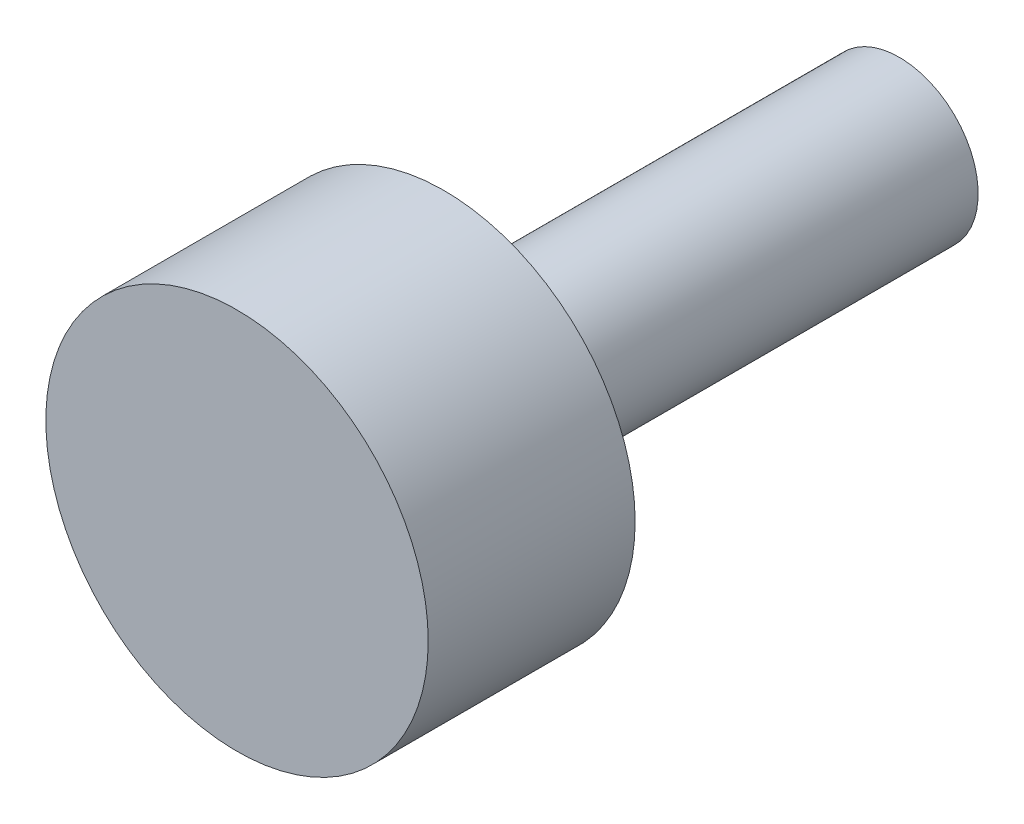
from build123d import *

# Parameters (mm, degrees)
SKETCH_1_R      = 8.5
EXTRUDE_1_DEPTH = 9.2
SKETCH_2_R      = 3.5
EXTRUDE_2_DEPTH = 20.25


with BuildPart() as part:
    # 草圖1 → 填料-伸長1 (new body)
    with BuildSketch(Plane.XY):
        with Locations((-43.165519845, -81.707444045)):
            Circle(SKETCH_1_R)
    extrude(amount=EXTRUDE_1_DEPTH)

    # 草圖2 → 填料-伸長2 (add)
    with BuildSketch(Plane(origin=(0, 0, 0), x_dir=(-1, 0, 0), z_dir=(0, 0, -1))):
        with Locations((43.165519845, -81.707444045)):
            Circle(SKETCH_2_R)
    extrude(amount=EXTRUDE_2_DEPTH)


solid = part.part
